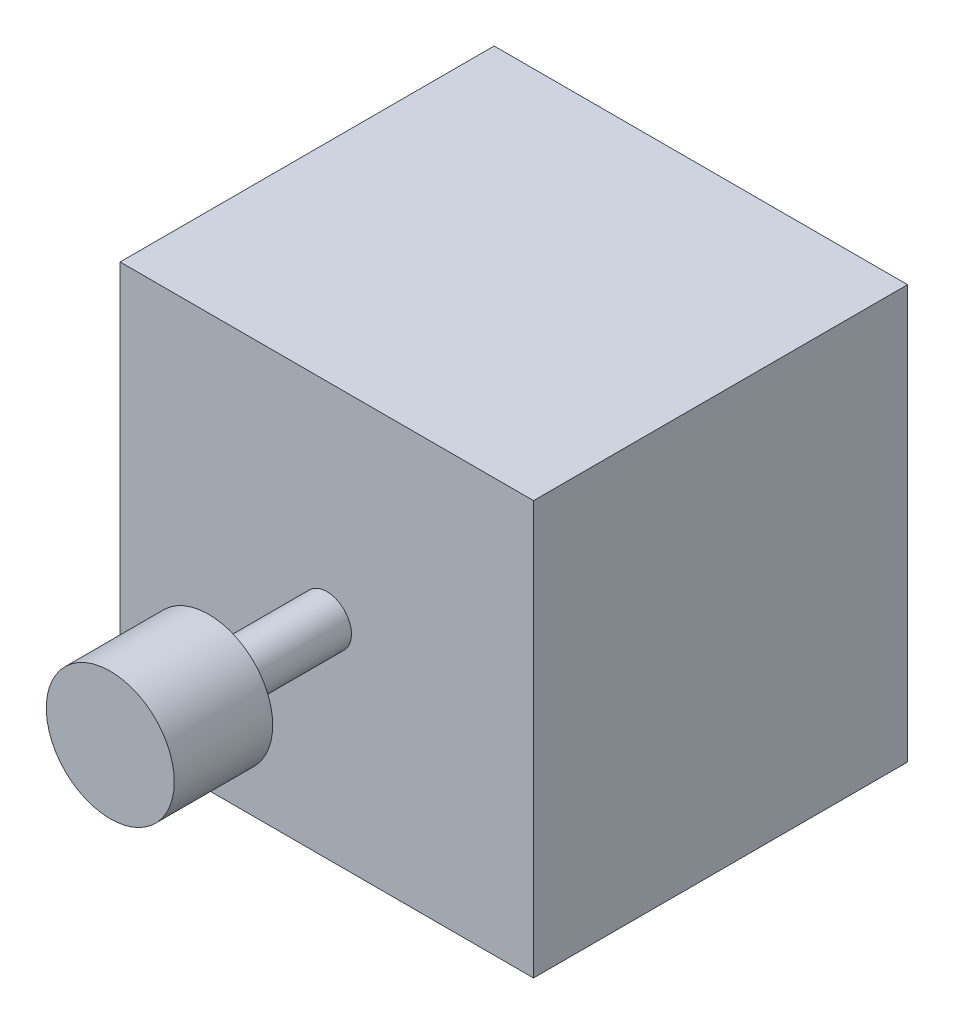
from build123d import *

# Parameters (mm, degrees)
SKETCH1_W           = 42
SKETCH1_H           = 42
BOSS_EXTRUDE1_DEPTH = 38
SKETCH2_R           = 2.5
BOSS_EXTRUDE2_DEPTH = 22
SKETCH3_R           = 6.5
BOSS_EXTRUDE3_DEPTH = 10


with BuildPart() as part:
    # Sketch1 → Boss-Extrude1 (new body)
    with BuildSketch(Plane.XY):
        Rectangle(SKETCH1_W, SKETCH1_H)
    extrude(amount=BOSS_EXTRUDE1_DEPTH)

    # Sketch2 → Boss-Extrude2 (add)
    with BuildSketch(Plane.XY.offset(38)):
        Circle(SKETCH2_R)
    extrude(amount=BOSS_EXTRUDE2_DEPTH)

    # Sketch3 → Boss-Extrude3 (add)
    with BuildSketch(Plane.XY.offset(60)):
        Circle(SKETCH3_R)
    extrude(amount=-BOSS_EXTRUDE3_DEPTH)


solid = part.part
